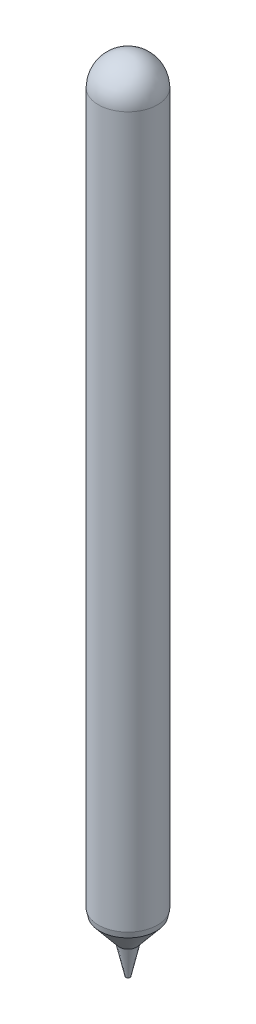
from build123d import *


with BuildPart() as part:
    # Sketch1 → Revolve S (revolve)
    with BuildSketch(Plane.XY):
        with BuildLine():
            Line((0, 3.924713059), (0, -126.075286941))
            Line((0, -126.075286941), (-0.35, -126.075286941))
            Line((-0.35, -126.075286941), (-1.399584714, -121.375170737))
            Line((-1.399584714, -121.375170737), (-1.466551877, -121.075286941))
            Line((-1.466551877, -121.075286941), (-4.784687787, -117.075286941))
            Line((-4.784687787, -117.075286941), (-5, -116.075286941))
            Line((-5, -116.075286941), (-5, 3.924713059))
            ThreePointArc((-5, 3.924713059), (-3.535533906, 7.460246965), (0, 8.924713059))
            Line((0, 8.924713059), (0, 3.924713059))
        make_face()
    revolve(axis=Axis((0, 3.924713059, 0), (0, -1, 0)))


solid = part.part
